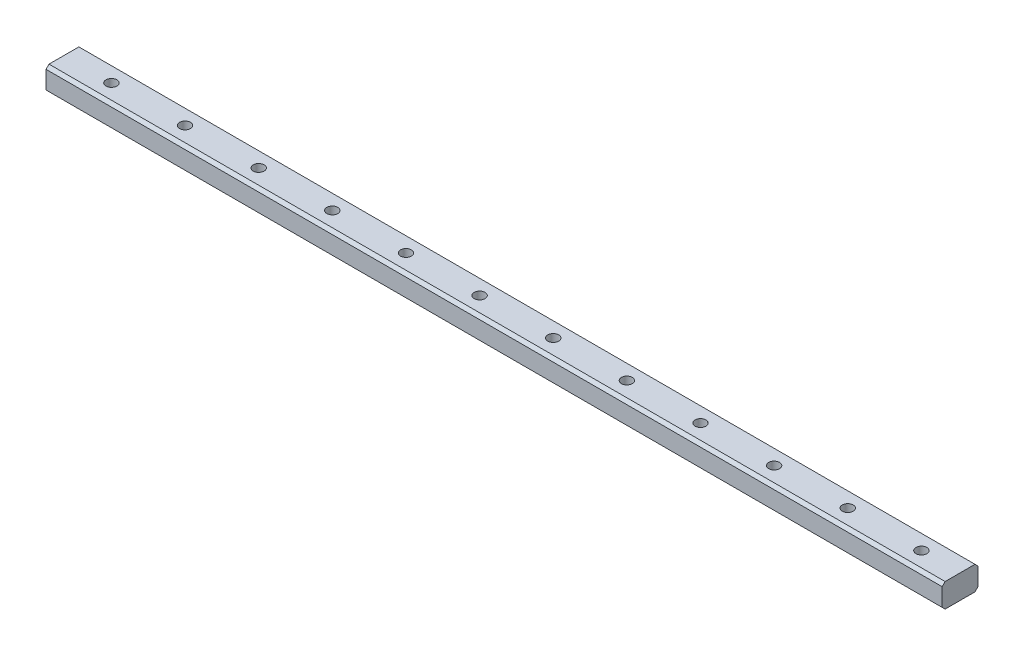
from build123d import *

# Parameters (mm, degrees)
SKETCH1_W           = 300
SKETCH1_H           = 12
BOSS_EXTRUDE1_DEPTH = 8
CHAMFER1_SIZE       = 1
SKETCH2_R           = 2.95
CUT_EXTRUDE1_DEPTH  = 5.05
SKETCH3_R           = 1.825
CUT_EXTRUDE2_DEPTH  = 151.332963784
LPATTERN2_COUNT     = 12
LPATTERN2_PITCH     = 24.65


with BuildPart() as part:
    # Sketch1 → Boss-Extrude1 (new body)
    with BuildSketch(Plane(origin=(0, 0, 0), x_dir=(1, 0, 0), z_dir=(0, 1, 0))):
        Rectangle(SKETCH1_W, SKETCH1_H)
    extrude(amount=BOSS_EXTRUDE1_DEPTH)

    # Chamfer1
    chamfer1_edges = [part.edges().sort_by_distance(p)[0] for p in [
        (0, 8, -6),
        (0, 0, -6),
        (0, 0, 6),
        (0, 8, 6),
    ]]
    chamfer(chamfer1_edges, length=CHAMFER1_SIZE)

    # Sketch2 → Cut-Extrude1 (cut)
    with BuildSketch(Plane(origin=(0, 0, 0), x_dir=(1, 0, 0), z_dir=(0, 1, 0))):
        with Locations(Location((137.05, 0, 0), (0, 0, 270))):
            Circle(SKETCH2_R)
    cut_extrude1 = extrude(amount=CUT_EXTRUDE1_DEPTH, mode=Mode.SUBTRACT)

    # Sketch3 → Cut-Extrude2 (cut, through all)
    with BuildSketch(Plane(origin=(0, 0, 0), x_dir=(1, 0, 0), z_dir=(0, 1, 0))):
        with Locations(Location((137.05, 0, 0), (0, 0, 270))):
            Circle(SKETCH3_R)
    cut_extrude2 = extrude(amount=CUT_EXTRUDE2_DEPTH, mode=Mode.SUBTRACT)

    # LPattern2: Cut-Extrude1, Cut-Extrude2 ×12
    with Locations(*[(-i * LPATTERN2_PITCH, 0, 0) for i in range(1, LPATTERN2_COUNT)]):
        add(cut_extrude1, mode=Mode.SUBTRACT)
        add(cut_extrude2, mode=Mode.SUBTRACT)


solid = part.part
